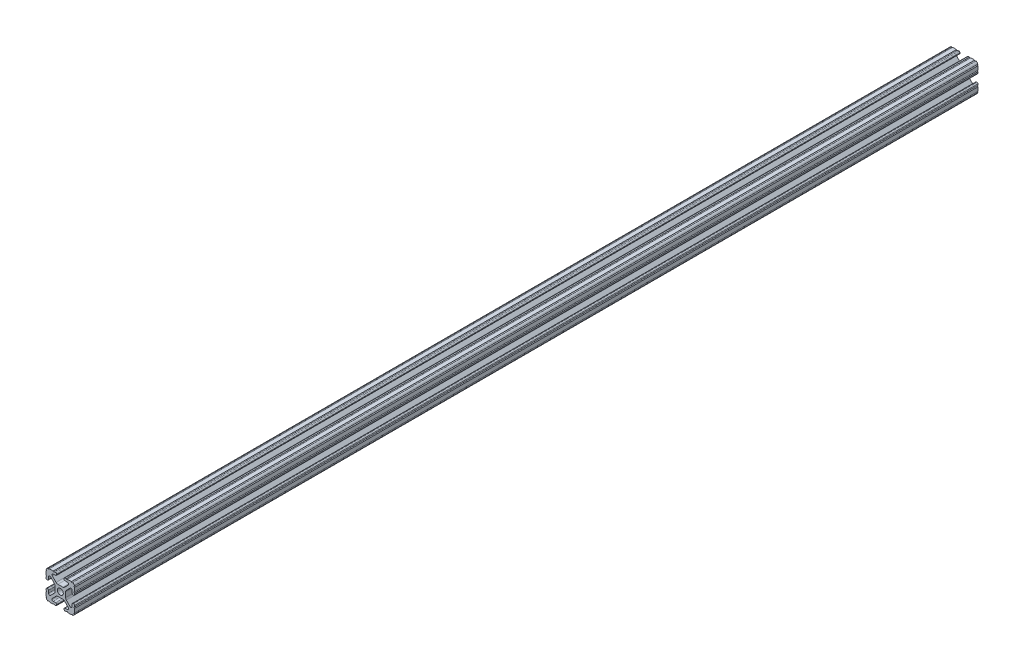
from build123d import *

# Parameters (mm, degrees)
BOSS_EXTRUDE1_DEPTH     = 400
CUT_EXTRUDE1_DEPTH      = 401.403021967
CUT_EXTRUDE1_DEPTH_BACK = 401.403021967
SKETCH5_R               = 0.55245


with BuildPart() as part:
    # Sketch4 → Boss-Extrude1 (new, symmetric)
    with BuildSketch(Plane.XY):
        with BuildLine():
            Line((4.190365, -12.7), (10.11729625, -12.7))
            ThreePointArc((10.11729625, -12.7), (11.943543585, -11.943543585), (12.7, -10.11729625))
            Line((12.7, -10.11729625), (12.7, -4.190365))
            ThreePointArc((12.7, -4.190365), (12.42492494, -3.52627506), (11.760835, -3.2512))
            Line((11.760835, -3.2512), (11.429365, -3.2512))
            ThreePointArc((11.429365, -3.2512), (10.76527506, -3.52627506), (10.4902, -4.190365))
            Line((10.4902, -4.190365), (10.4902, -6.348478019))
            ThreePointArc((10.4902, -6.348478019), (9.830707141, -7.335478831), (8.666460301, -7.103895736))
            Line((8.666460301, -7.103895736), (5.299899128, -3.737334563))
            ThreePointArc((5.299899128, -3.737334563), (4.817571085, -3.015479634), (4.6482, -2.16399369))
            Line((4.6482, -2.16399369), (4.6482, 0))
            Line((4.6482, 0), (2.6035, 0))
            ThreePointArc((2.6035, 0), (1.840952505, -1.840952505), (0, -2.6035))
            Line((0, -2.6035), (0, -4.6482))
            Line((0, -4.6482), (2.16399369, -4.6482))
            ThreePointArc((2.16399369, -4.6482), (3.015479634, -4.817571085), (3.737334563, -5.299899128))
            Line((3.737334563, -5.299899128), (7.103895736, -8.666460301))
            ThreePointArc((7.103895736, -8.666460301), (7.335478831, -9.830707141), (6.348478019, -10.4902))
            Line((6.348478019, -10.4902), (4.190365, -10.4902))
            ThreePointArc((4.190365, -10.4902), (3.52627506, -10.76527506), (3.2512, -11.429365))
            Line((3.2512, -11.429365), (3.2512, -11.760835))
            ThreePointArc((3.2512, -11.760835), (3.52627506, -12.42492494), (4.190365, -12.7))
        make_face()
    extrude(amount=BOSS_EXTRUDE1_DEPTH, both=True)

    # Sketch5 → Cut-Extrude1 (cut, two sides: drawn at the far end of the back side and taken through both)
    with BuildSketch(Plane.XY.offset(-CUT_EXTRUDE1_DEPTH_BACK)):
        with Locations((10.356153152, -12.7)):
            Circle(SKETCH5_R)
        with Locations((5.796028019, -12.7)):
            Circle(SKETCH5_R)
        with Locations((12.7, -10.356153152)):
            Circle(SKETCH5_R)
        with Locations((12.7, -5.796028019)):
            Circle(SKETCH5_R)
    extrude(amount=CUT_EXTRUDE1_DEPTH + CUT_EXTRUDE1_DEPTH_BACK, mode=Mode.SUBTRACT)

    # Mirror1: part across plane


with BuildPart() as part_1:
    add(part.part)
    add(part.part.mirror(Plane(origin=(0, 0, 0), x_dir=(0, 0, 1), z_dir=(1, 0, 0))))

    # Mirror2: part across plane


with BuildPart() as part_2:
    add(part_1.part)
    add(part_1.part.mirror(Plane.ZX))


solid = part_2.part
